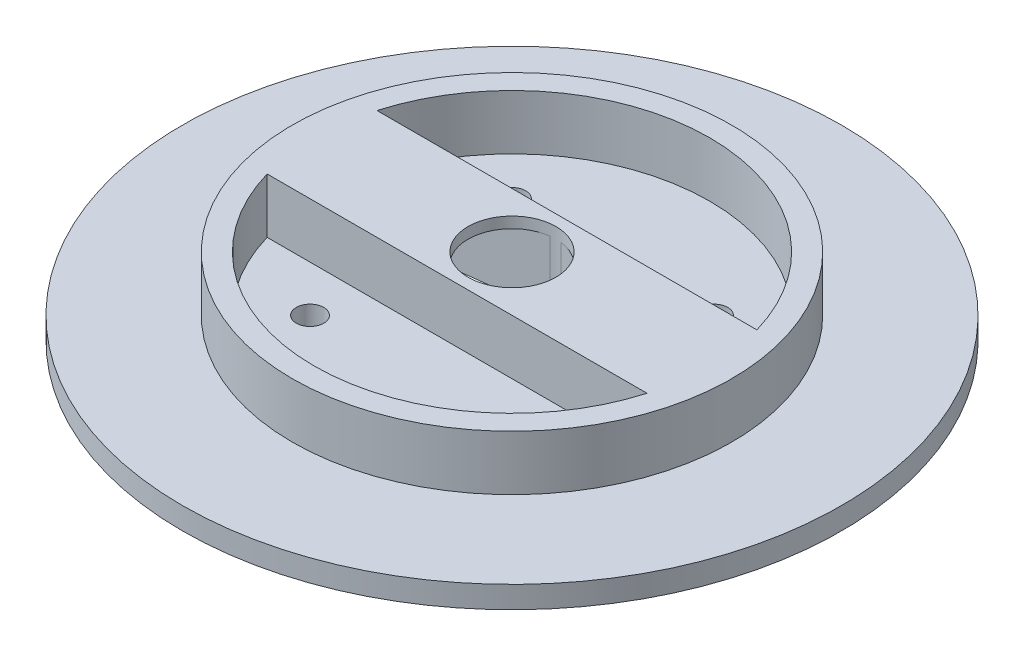
from build123d import *

# Parameters (mm, degrees)
SKETCH_1_R          = 30
SKETCH_1_R_2        = 1.25
EXTRUDE_1_DEPTH     = 2
SKETCH_2_R          = 20
EXTRUDE_2_DEPTH     = 5
CUT_EXTRUDE_1_DEPTH = 6
SKETCH_5_R          = 4
CUT_EXTRUDE_2_DEPTH = 6


with BuildPart() as part:
    # 草图1 → 凸台-拉伸1 (new body)
    with BuildSketch(Plane(origin=(0, 0, 0), x_dir=(1, 0, 0), z_dir=(0, 1, 0))):
        with Locations(Location((0, 0, 0), (0, 0, 270))):
            Circle(SKETCH_1_R)
        with Locations(Location((9.192388155, 9.192388155, 0), (0, 0, 270))):
            Circle(SKETCH_1_R_2, mode=Mode.SUBTRACT)
        with Locations(Location((9.192388155, -9.192388155, 0), (0, 0, 270))):
            Circle(SKETCH_1_R_2, mode=Mode.SUBTRACT)
        with Locations(Location((-9.192388155, -9.192388155, 0), (0, 0, 270))):
            Circle(SKETCH_1_R_2, mode=Mode.SUBTRACT)
        with Locations(Location((-9.192388155, 9.192388155, 0), (0, 0, 270))):
            Circle(SKETCH_1_R_2, mode=Mode.SUBTRACT)
    extrude(amount=EXTRUDE_1_DEPTH)

    # 草图2 → 凸台-拉伸2 (add)
    with BuildSketch(Plane(origin=(0, 2, 0), x_dir=(1, 0, 0), z_dir=(0, 1, 0))):
        with Locations(Location((0, 0, 0), (0, 0, 270))):
            Circle(SKETCH_2_R)
        with BuildLine():
            Line((-17.291616466, 5), (17.291616466, 5))
            ThreePointArc((17.291616466, 5), (0, 18), (-17.291616466, 5))
        make_face(mode=Mode.SUBTRACT)
        with BuildLine():
            Line((-17.291616466, -5), (17.291616466, -5))
            ThreePointArc((17.291616466, -5), (0, -18), (-17.291616466, -5))
        make_face(mode=Mode.SUBTRACT)
    extrude(amount=EXTRUDE_2_DEPTH)

    # 草图4 → 切除-拉伸1 (cut)
    with BuildSketch(Plane(origin=(0, 0, 0), x_dir=(-1, 0, 0), z_dir=(0, -1, 0))):
        with BuildLine():
            Line((-0.5, -3.968626967), (-16.25, -1.984313483))
            ThreePointArc((-16.25, -1.984313483), (-18, 0), (-16.25, 1.984313483))
            Line((-16.25, 1.984313483), (-0.5, 3.968626967))
            ThreePointArc((-0.5, 3.968626967), (0, 4), (0.5, 3.968626967))
            Line((0.5, 3.968626967), (16.25, 1.984313483))
            ThreePointArc((16.25, 1.984313483), (18, 0), (16.25, -1.984313483))
            Line((16.25, -1.984313483), (0.5, -3.968626967))
            ThreePointArc((0.5, -3.968626967), (0, -4), (-0.5, -3.968626967))
        make_face()
    extrude(amount=-CUT_EXTRUDE_1_DEPTH, mode=Mode.SUBTRACT)

    # 草图5 → 切除-拉伸2 (cut)
    with BuildSketch(Plane(origin=(0, 6, 0), x_dir=(-1, 0, 0), z_dir=(0, -1, 0))):
        with Locations(Location((0, 0, 0), (0, 0, 97.180755781))):
            Circle(SKETCH_5_R)
    extrude(amount=-CUT_EXTRUDE_2_DEPTH, mode=Mode.SUBTRACT)


solid = part.part
